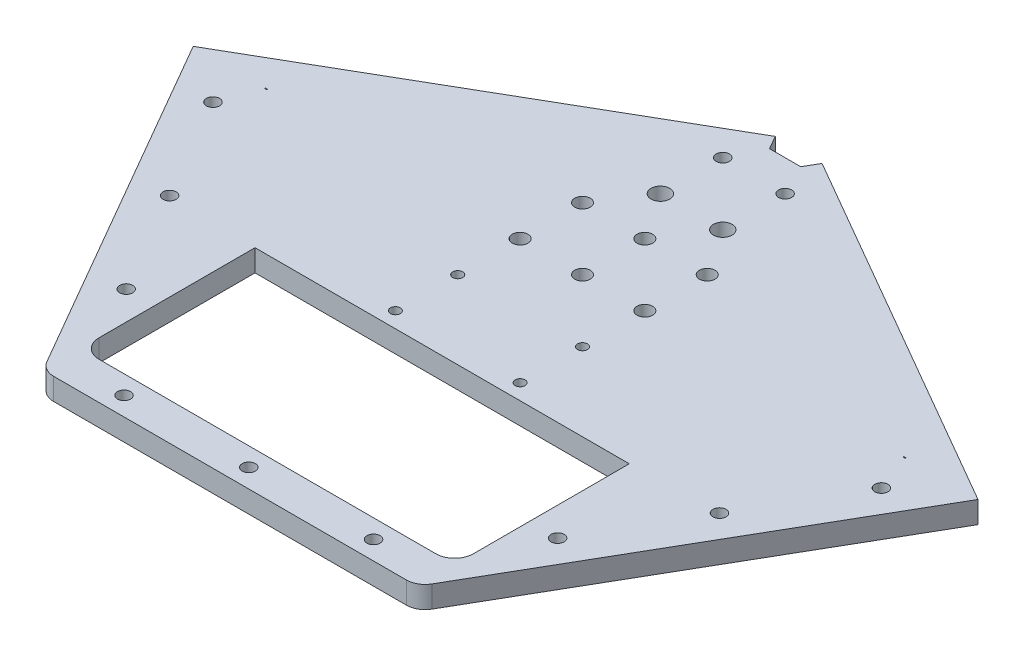
from build123d import *

# Parameters (mm, degrees)
SKETCH1_R           = 2.5
SKETCH1_R_2         = 2.1
SKETCH1_R_3         = 1.6
SKETCH1_W           = 120
SKETCH1_H           = 56
SKETCH1_R_4         = 3
BOSS_EXTRUDE1_DEPTH = 7
FILLET1_R           = 6


with BuildPart() as part:
    # Sketch1 → Boss-Extrude1 (new body)
    with BuildSketch(Plane(origin=(0, 0, 0), x_dir=(1, 0, 0), z_dir=(0, 1, 0))):
        Polygon((-125.817930688, 74), (-60, -40), (60, -40), (125.817930688, 74), (7.5, 142.310889132), (5, 137.980762114), (-5, 137.980762114), (-7.5, 142.310889132), align=None)
        Polygon((-102.497422612, 73.607695155), (-102.72391992, 74), (-101.817930688, 74), align=None, mode=Mode.SUBTRACT)
        with Locations((-20, 73)):
            Circle(SKETCH1_R, mode=Mode.SUBTRACT)
        with Locations((0, 73)):
            Circle(SKETCH1_R, mode=Mode.SUBTRACT)
        with Locations((20, 73)):
            Circle(SKETCH1_R, mode=Mode.SUBTRACT)
        Polygon((102.72391992, 74), (102.497422612, 73.607695155), (101.817930688, 74), align=None, mode=Mode.SUBTRACT)
        with Locations((-69.15767665, -4.138438763)):
            Circle(SKETCH1_R_2, mode=Mode.SUBTRACT)
        with Locations((-40, -34)):
            Circle(SKETCH1_R_2, mode=Mode.SUBTRACT)
        with Locations((-88.15767665, 28.770526581)):
            Circle(SKETCH1_R_2, mode=Mode.SUBTRACT)
        with Locations((-107.15767665, 61.679491924)):
            Circle(SKETCH1_R_2, mode=Mode.SUBTRACT)
        with Locations((-20, 33)):
            Circle(SKETCH1_R_3, mode=Mode.SUBTRACT)
        with Locations((-20, 53)):
            Circle(SKETCH1_R_3, mode=Mode.SUBTRACT)
        with Locations((0, -34)):
            Circle(SKETCH1_R_2, mode=Mode.SUBTRACT)
        with Locations((40, -34)):
            Circle(SKETCH1_R_2, mode=Mode.SUBTRACT)
        Rectangle(SKETCH1_W, SKETCH1_H, mode=Mode.SUBTRACT)
        with Locations((69.15767665, -4.138438763)):
            Circle(SKETCH1_R_2, mode=Mode.SUBTRACT)
        with Locations((20, 33)):
            Circle(SKETCH1_R_3, mode=Mode.SUBTRACT)
        with Locations((20, 53)):
            Circle(SKETCH1_R_3, mode=Mode.SUBTRACT)
        with Locations((88.15767665, 28.770526581)):
            Circle(SKETCH1_R_2, mode=Mode.SUBTRACT)
        with Locations((107.15767665, 61.679491924)):
            Circle(SKETCH1_R_2, mode=Mode.SUBTRACT)
        with Locations((-10, 107.980762114)):
            Circle(SKETCH1_R_4, mode=Mode.SUBTRACT)
        with Locations((10, 107.980762114)):
            Circle(SKETCH1_R_4, mode=Mode.SUBTRACT)
        with Locations((-20, 93)):
            Circle(SKETCH1_R, mode=Mode.SUBTRACT)
        with BuildLine():
            ThreePointArc((-2.5, 93), (0, 95.5), (2.5, 93))
            ThreePointArc((2.5, 93), (0, 90.5), (-2.5, 93))
        make_face(mode=Mode.SUBTRACT)
        with BuildLine():
            ThreePointArc((20, 90.5), (18.232233047, 91.232233047), (17.5, 93))
            ThreePointArc((17.5, 93), (21.767766953, 94.767766953), (20, 90.5))
        make_face(mode=Mode.SUBTRACT)
        with Locations((-10, 127.980762114)):
            Circle(SKETCH1_R_2, mode=Mode.SUBTRACT)
        with Locations((10, 127.980762114)):
            Circle(SKETCH1_R_2, mode=Mode.SUBTRACT)
    extrude(amount=BOSS_EXTRUDE1_DEPTH)

    # Fillet1
    fillet1_edges = [part.edges().sort_by_distance(p)[0] for p in [
        (-60, 3.5, 28),
        (60, 3.5, 28),
        (60, 3.5, 40),
        (-60, 3.5, 40),
    ]]
    fillet(fillet1_edges, radius=FILLET1_R)


solid = part.part
